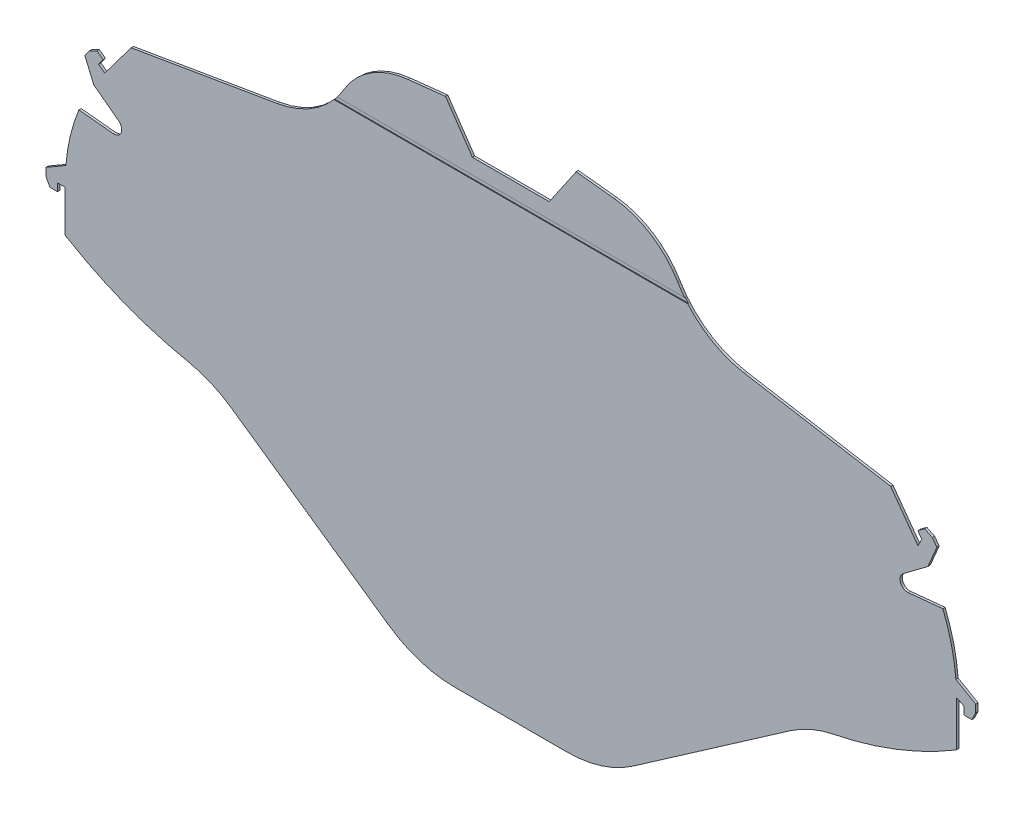
from build123d import *

# Parameters (mm, degrees)
MAIN_SHAPE_DEPTH               = 0.6
TABS_DEPTH                     = 154.060061459
TABS_DEPTH_BACK                = 154.060061459
CHIN_GUARD_DEPTH               = 0.6
FILLET1_R                      = 30
QUICK_RELEASE_NOTCH_DEPTH      = 172.662513141
QUICK_RELEASE_NOTCH_DEPTH_BACK = 172.662513141
SKETCH8_W                      = 100
SKETCH8_H                      = 1
CUT_EXTRUDE3_DEPTH             = 0.2


with BuildPart() as part:
    # Sketch1 → Main Shape (new body)
    with BuildSketch(Plane.XY):
        with BuildLine():
            Line((-24, -91.764766734), (24, -91.764766734))
            Line((24, -91.764766734), (78.266232563, -84.05670244))
            ThreePointArc((78.266232563, -84.05670244), (97.655491519, -79.289252293), (115.711102551, -70.764766734))
            ThreePointArc((115.711102551, -70.764766734), (120.685143325, -65.658407438), (122.5, -58.764766734))
            ThreePointArc((122.5, -58.764766734), (120.227482046, -43.118277124), (113.597722286, -28.764766734))
            ThreePointArc((113.597722286, -28.764766734), (107.811505455, -22.955172168), (100.180351554, -19.955641477))
            Line((100.180351554, -19.955641477), (60.74391922, -13.264766734))
            ThreePointArc((60.74391922, -13.264766734), (50.804108255, -9.246591688), (43.461443341, -1.434367632))
            ThreePointArc((43.461443341, -1.434367632), (36.448172688, 5.805997675), (26.941855461, 9.15842781))
            Line((26.941855461, 9.15842781), (17, 10.235233266))
            Line((17, 10.235233266), (10, 0))
            Line((10, 0), (-10, 0))
            Line((-10, 0), (-17, 10.235233266))
            Line((-17, 10.235233266), (-26.941855461, 9.15842781))
            ThreePointArc((-26.941855461, 9.15842781), (-36.448172688, 5.805997675), (-43.461443341, -1.434367632))
            ThreePointArc((-43.461443341, -1.434367632), (-50.804108255, -9.246591688), (-60.74391922, -13.264766734))
            Line((-60.74391922, -13.264766734), (-100.180351554, -19.955641477))
            ThreePointArc((-100.180351554, -19.955641477), (-107.811505455, -22.955172168), (-113.597722286, -28.764766734))
            ThreePointArc((-113.597722286, -28.764766734), (-120.227482046, -43.118277124), (-122.5, -58.764766734))
            ThreePointArc((-122.5, -58.764766734), (-120.685143325, -65.658407438), (-115.711102551, -70.764766734))
            ThreePointArc((-115.711102551, -70.764766734), (-97.655491519, -79.289252293), (-78.266232563, -84.05670244))
            Line((-78.266232563, -84.05670244), (-24, -91.764766734))
        make_face()
    extrude(amount=MAIN_SHAPE_DEPTH)

    # Sketch2 → Tabs (cut, two sides: drawn at the far end of the back side and taken through both)
    with BuildSketch(Plane.XY.offset(0.6).offset(-TABS_DEPTH_BACK)):
        with BuildLine():
            Line((-121, -59.764766734), (-121, -57.764766734))
            Line((-121, -57.764766734), (-115.834995394, -54.767490128))
            ThreePointArc((-115.834995394, -54.767490128), (-113.511139955, -43.427720083), (-108.566362279, -32.961590783))
            Line((-108.566362279, -32.961590783), (-110.9, -27.464766734))
            Line((-110.9, -27.464766734), (-109.7, -25.864766734))
            Line((-109.7, -25.864766734), (-107.7, -24.864766734))
            Line((-107.7, -24.864766734), (-106.1, -26.064766734))
            Line((-106.1, -26.064766734), (-107.3, -27.664766734))
            Line((-107.3, -27.664766734), (-105.7, -28.864766734))
            Line((-105.7, -28.864766734), (-98.84870892, -19.729711961))
            Line((-98.84870892, -19.729711961), (-100.180351554, -19.955641477))
            ThreePointArc((-100.180351554, -19.955641477), (-107.811505455, -22.955172168), (-113.597722286, -28.764766734))
            ThreePointArc((-113.597722286, -28.764766734), (-120.227482046, -43.118277124), (-122.5, -58.764766734))
            ThreePointArc((-122.5, -58.764766734), (-120.767844146, -65.510135516), (-116, -70.586357152))
            Line((-116, -70.586357152), (-116, -59.764766734))
            Line((-116, -59.764766734), (-118, -59.764766734))
            Line((-118, -59.764766734), (-118, -61.764766734))
            Line((-118, -61.764766734), (-120, -61.764766734))
            Line((-120, -61.764766734), (-121, -59.764766734))
        make_face()
        with BuildLine():
            Line((109.7, -25.864766734), (110.9, -27.464766734))
            Line((110.9, -27.464766734), (108.566362279, -32.961590783))
            ThreePointArc((108.566362279, -32.961590783), (113.511139955, -43.427720083), (115.834995394, -54.767490128))
            Line((115.834995394, -54.767490128), (121, -57.764766734))
            Line((121, -57.764766734), (121, -59.764766734))
            Line((121, -59.764766734), (120, -61.764766734))
            Line((120, -61.764766734), (118, -61.764766734))
            Line((118, -61.764766734), (118, -59.764766734))
            Line((118, -59.764766734), (116, -58.764766734))
            Line((116, -58.764766734), (116, -70.586357152))
            ThreePointArc((116, -70.586357152), (120.767844146, -65.510135516), (122.5, -58.764766734))
            ThreePointArc((122.5, -58.764766734), (120.227482046, -43.118277124), (113.597722286, -28.764766734))
            ThreePointArc((113.597722286, -28.764766734), (107.811505455, -22.955172168), (100.180351554, -19.955641477))
            Line((100.180351554, -19.955641477), (98.84870892, -19.729711961))
            Line((98.84870892, -19.729711961), (105.979039493, -29.610311845))
            Line((105.979039493, -29.610311845), (106.979039493, -27.610311845))
            Line((106.979039493, -27.610311845), (105.920723622, -26.199224018))
            Line((105.920723622, -26.199224018), (107.7, -24.864766734))
            Line((107.7, -24.864766734), (109.7, -25.864766734))
        make_face()
    extrude(amount=TABS_DEPTH + TABS_DEPTH_BACK, mode=Mode.SUBTRACT)

    # Sketch5 → Chin guard (add)
    with BuildSketch(Plane.XY.offset(0.6)):
        Polygon((-78.266232563, -84.05670244), (-24, -121.764766734), (24, -121.764766734), (78.266232563, -84.05670244), (24, -91.764766734), (-24, -91.764766734), align=None)
    extrude(amount=-CHIN_GUARD_DEPTH)

    # Fillet1
    fillet1_edges = [part.edges().sort_by_distance(p)[0] for p in [
        (-24, -121.764766734, 0.3),
        (24, -121.764766734, 0.3),
        (78.266232563, -84.05670244, 0.3),
        (-78.266232563, -84.05670244, 0.3),
    ]]
    fillet(fillet1_edges, radius=FILLET1_R)

    # Sketch7 → Quick Release Notch (cut, two sides: drawn at the far end of the back side and taken through both)
    with BuildSketch(Plane.XY.offset(0.6).offset(-QUICK_RELEASE_NOTCH_DEPTH_BACK)):
        with BuildLine():
            Line((-103.483971257, -41.410990303), (-112.440490058, -40.52737785))
            ThreePointArc((-112.440490058, -40.52737785), (-110.669490914, -36.659449404), (-108.566362279, -32.961590783))
            Line((-108.566362279, -32.961590783), (-102.087612935, -37.820652791))
            ThreePointArc((-102.087612935, -37.820652791), (-101.423623928, -40.145597606), (-103.483971257, -41.410990303))
        make_face()
        with BuildLine():
            Line((108.566362279, -32.961590783), (102.087612935, -37.820652791))
            ThreePointArc((102.087612935, -37.820652791), (101.423623928, -40.145597606), (103.483971257, -41.410990303))
            Line((103.483971257, -41.410990303), (112.440490058, -40.52737785))
            ThreePointArc((112.440490058, -40.52737785), (110.669490914, -36.659449404), (108.566362279, -32.961590783))
        make_face()
    extrude(amount=QUICK_RELEASE_NOTCH_DEPTH + QUICK_RELEASE_NOTCH_DEPTH_BACK, mode=Mode.SUBTRACT)

    # Sketch8 → Cut-Extrude3 (cut)
    with BuildSketch(Plane.XY.offset(0.6)):
        with Locations((0, -4.5)):
            Rectangle(SKETCH8_W, SKETCH8_H)
    extrude(amount=-CUT_EXTRUDE3_DEPTH, mode=Mode.SUBTRACT)


solid = part.part
